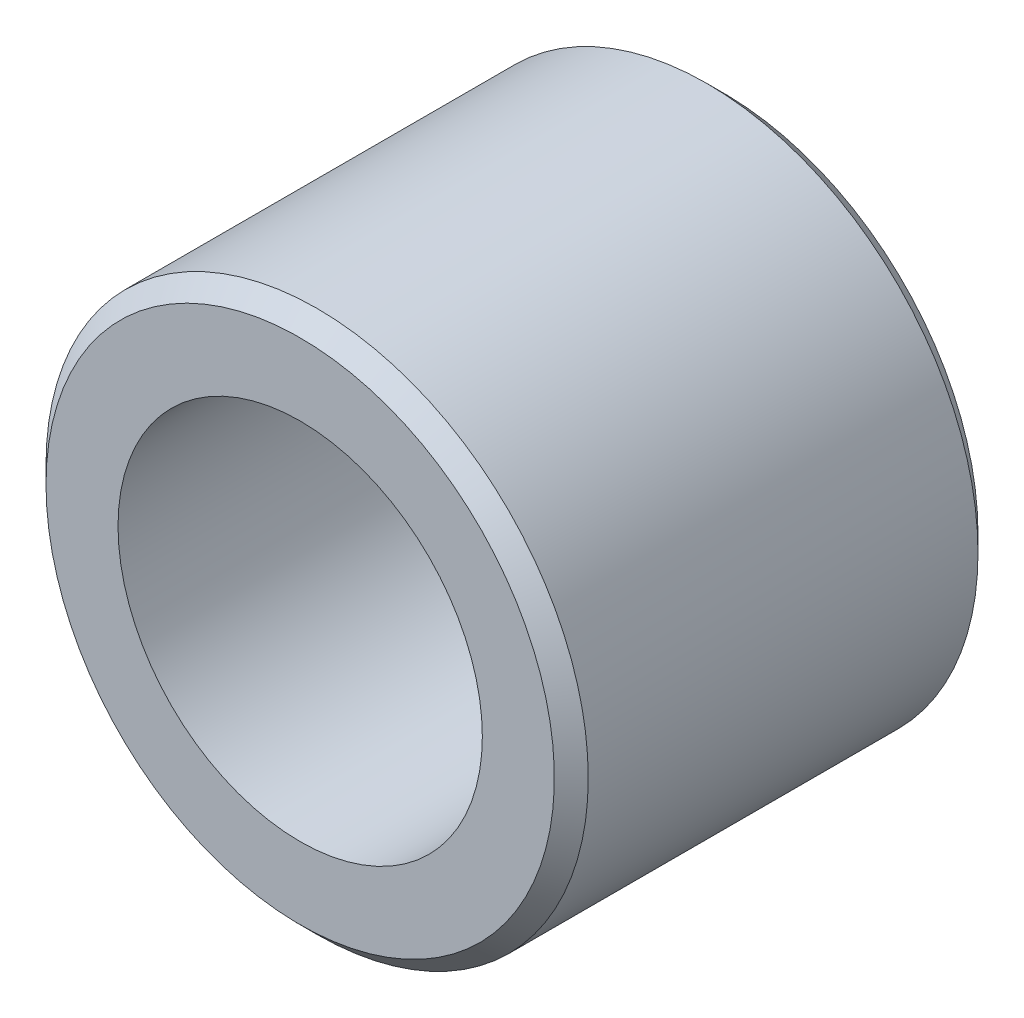
from build123d import *

# Parameters (mm, degrees)
SKETCH1_R           = 6.4
SKETCH1_R_2         = 4.3
BOSS_EXTRUDE1_DEPTH = 10
CHAMFER1_SIZE       = 0.4


with BuildPart() as part:
    # Sketch1 → Boss-Extrude1 (new body)
    with BuildSketch(Plane.XY):
        Circle(SKETCH1_R)
        Circle(SKETCH1_R_2, mode=Mode.SUBTRACT)
    extrude(amount=BOSS_EXTRUDE1_DEPTH)

    # Chamfer1
    chamfer1_edges = [part.edges().sort_by_distance(p)[0] for p in [
        (-6.4, 0, 0),
        (-6.4, 0, 10),
    ]]
    chamfer(chamfer1_edges, length=CHAMFER1_SIZE)


solid = part.part
